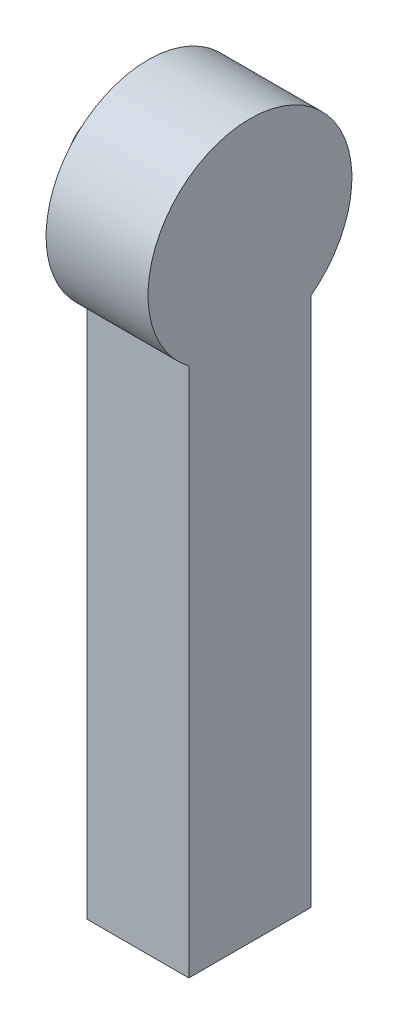
from build123d import *

# Parameters (mm, degrees)
SKETCH_1_R      = 1.5
EXTRUDE_1_DEPTH = 2.5
SKETCH_2_R      = 5
EXTRUDE_2_DEPTH = 5
SKETCH_3_W      = 5
SKETCH_3_H      = 6
EXTRUDE_3_DEPTH = 30


with BuildPart() as part:
    # 草图1 → 凸台-拉伸1 (new body)
    with BuildSketch(Plane(origin=(0, 0, 0), x_dir=(0, 0, -1), z_dir=(1, 0, 0))):
        Circle(SKETCH_1_R)
    extrude(amount=EXTRUDE_1_DEPTH)

    # 草图2 → 凸台-拉伸2 (add)
    with BuildSketch(Plane(origin=(2.5, 0, 0), x_dir=(0, 0, -1), z_dir=(1, 0, 0))):
        Circle(SKETCH_2_R)
    extrude(amount=EXTRUDE_2_DEPTH)

    # 草图3 → 凸台-拉伸3 (add)
    with BuildSketch(Plane(origin=(0, 0, 0), x_dir=(1, 0, 0), z_dir=(0, 1, 0))):
        with Locations((5, 0)):
            Rectangle(SKETCH_3_W, SKETCH_3_H)
    extrude(amount=-EXTRUDE_3_DEPTH)


solid = part.part
